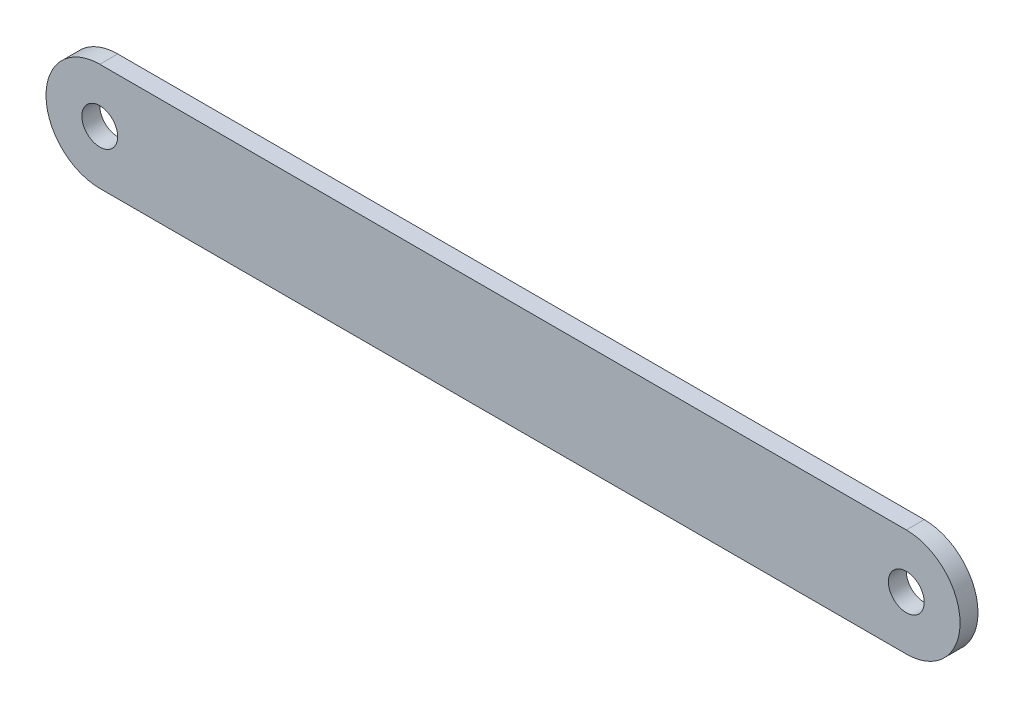
from build123d import *

# Parameters (mm, degrees)
SKETCH1_R           = 20
BOSS_EXTRUDE1_DEPTH = 20


with BuildPart() as part:
    # Sketch1 → Boss-Extrude1 (new body)
    with BuildSketch(Plane.XY):
        with BuildLine():
            Line((-450, 60), (450, 60))
            ThreePointArc((450, 60), (510, 0), (450, -60))
            Line((450, -60), (-450, -60))
            ThreePointArc((-450, -60), (-510, 0), (-450, 60))
        make_face()
        with Locations((450, 0)):
            Circle(SKETCH1_R, mode=Mode.SUBTRACT)
        with Locations((-450, 0)):
            Circle(SKETCH1_R, mode=Mode.SUBTRACT)
    extrude(amount=BOSS_EXTRUDE1_DEPTH)


solid = part.part
